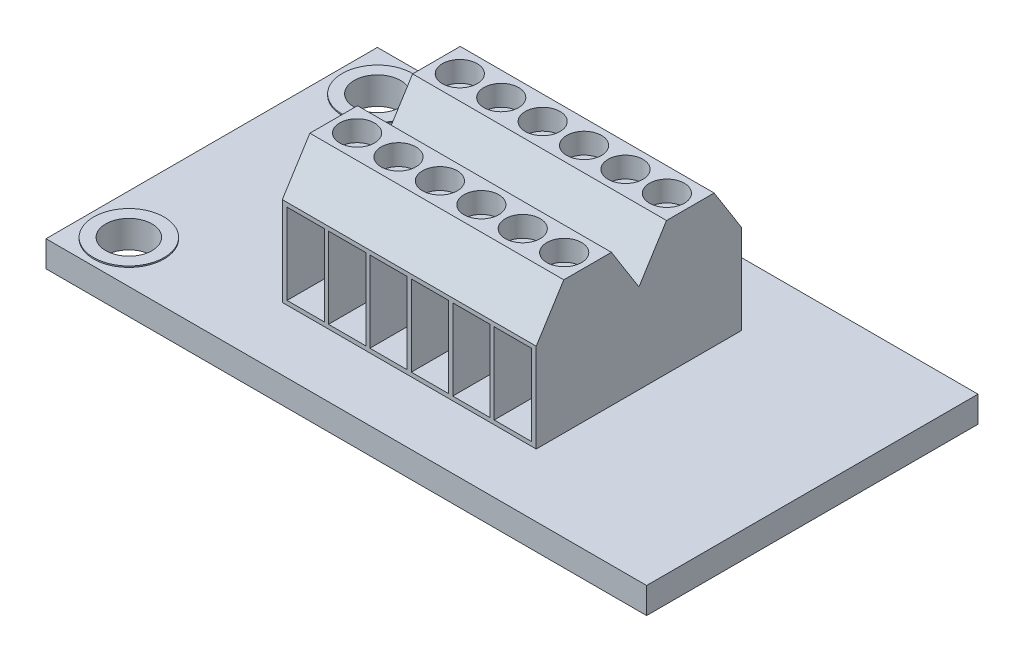
from build123d import *

# Parameters (mm, degrees)
SKETCH1_W           = 36.83
SKETCH1_H           = 20.32
BOSS_EXTRUDE1_DEPTH = 1.6002
SKETCH5_R           = 1.4224
CUT_EXTRUDE3_DEPTH  = 22.092616363
BOSS_EXTRUDE2_DEPTH = 7.7851
BOSS_EXTRUDE3_DEPTH = 7.7851
SKETCH11_W          = 2.286
SKETCH11_H          = 4.953
CUT_EXTRUDE5_DEPTH  = 2.54
SKETCH12_W          = 2.286
SKETCH12_H          = 4.953
CUT_EXTRUDE6_DEPTH  = 2.54
SKETCH13_R          = 1.0668
CUT_EXTRUDE7_DEPTH  = 1.27
SKETCH17_R          = 1.0668
CUT_EXTRUDE9_DEPTH  = 1.27
SKETCH21_R          = 2.159
SKETCH21_R_2        = 1.4224
BOSS_EXTRUDE5_DEPTH = 0.0762


with BuildPart() as part:
    # Sketch1 → Boss-Extrude1 (new body)
    with BuildSketch(Plane(origin=(0, 0, 0), x_dir=(1, 0, 0), z_dir=(0, 1, 0))):
        Rectangle(SKETCH1_W, SKETCH1_H)
    extrude(amount=BOSS_EXTRUDE1_DEPTH)

    # Sketch5 → Cut-Extrude3 (cut, through all)
    with BuildSketch(Plane(origin=(0, 0, 0), x_dir=(1, 0, 0), z_dir=(0, 1, 0))):
        with Locations(Location((-15.875, 7.62, 0), (0, 0, 270))):
            Circle(SKETCH5_R)
        with Locations(Location((-15.875, -7.62, 0), (0, 0, 270))):
            Circle(SKETCH5_R)
    extrude(amount=CUT_EXTRUDE3_DEPTH, mode=Mode.SUBTRACT)

    # Sketch8 → Boss-Extrude2 (add, symmetric)
    with BuildSketch(Plane(origin=(0, 0, 0), x_dir=(0, 0, -1), z_dir=(1, 0, 0))):
        Polygon((0, 1.6002), (6.2992, 1.6002), (6.2992, 7.0612), (4.6101, 9.742765812), (1.6891, 9.742765812), (0, 7.0612), align=None)
    extrude(amount=BOSS_EXTRUDE2_DEPTH, both=True)

    # Sketch10 → Boss-Extrude3 (add, symmetric)
    with BuildSketch(Plane(origin=(0, 0, 0), x_dir=(0, 0, -1), z_dir=(1, 0, 0))):
        Polygon((-6.2992, 1.6002), (0, 1.6002), (0, 7.0612), (-1.6891, 9.742765812), (-4.6101, 9.742765812), (-6.2992, 7.0612), align=None)
    extrude(amount=BOSS_EXTRUDE3_DEPTH, both=True)

    # Sketch11 → Cut-Extrude5 (cut)
    with BuildSketch(Plane.XY.offset(6.2992)):
        with Locations((-1.27, 4.3307)):
            Rectangle(SKETCH11_W, SKETCH11_H)
        with Locations((-3.81, 4.3307)):
            Rectangle(SKETCH11_W, SKETCH11_H)
        with Locations((-6.35, 4.3307)):
            Rectangle(SKETCH11_W, SKETCH11_H)
        with Locations((1.27, 4.3307)):
            Rectangle(SKETCH11_W, SKETCH11_H)
        with Locations((3.81, 4.3307)):
            Rectangle(SKETCH11_W, SKETCH11_H)
        with Locations((6.35, 4.3307)):
            Rectangle(SKETCH11_W, SKETCH11_H)
    extrude(amount=-CUT_EXTRUDE5_DEPTH, mode=Mode.SUBTRACT)

    # Sketch12 → Cut-Extrude6 (cut)
    with BuildSketch(Plane(origin=(0, 0, -6.2992), x_dir=(-1, 0, 0), z_dir=(0, 0, -1))):
        with Locations((-1.27, 4.3307)):
            Rectangle(SKETCH12_W, SKETCH12_H)
        with Locations((-3.81, 4.3307)):
            Rectangle(SKETCH12_W, SKETCH12_H)
        with Locations((-6.35, 4.3307)):
            Rectangle(SKETCH12_W, SKETCH12_H)
        with Locations((1.27, 4.3307)):
            Rectangle(SKETCH12_W, SKETCH12_H)
        with Locations((3.81, 4.3307)):
            Rectangle(SKETCH12_W, SKETCH12_H)
        with Locations((6.35, 4.3307)):
            Rectangle(SKETCH12_W, SKETCH12_H)
    extrude(amount=-CUT_EXTRUDE6_DEPTH, mode=Mode.SUBTRACT)

    # Sketch13 → Cut-Extrude7 (cut)
    with BuildSketch(Plane(origin=(0, 9.742765812, 0), x_dir=(1, 0, 0), z_dir=(0, 1, 0))):
        with Locations(Location((-1.27, -3.1496, 0), (0, 0, 270))):
            Circle(SKETCH13_R)
        with Locations(Location((-3.81, -3.1496, 0), (0, 0, 270))):
            Circle(SKETCH13_R)
        with Locations(Location((-6.35, -3.1496, 0), (0, 0, 270))):
            Circle(SKETCH13_R)
        with Locations(Location((1.27, -3.1496, 0), (0, 0, 270))):
            Circle(SKETCH13_R)
        with Locations(Location((3.81, -3.1496, 0), (0, 0, 270))):
            Circle(SKETCH13_R)
        with Locations(Location((6.35, -3.1496, 0), (0, 0, 270))):
            Circle(SKETCH13_R)
    extrude(amount=-CUT_EXTRUDE7_DEPTH, mode=Mode.SUBTRACT)

    # Sketch17 → Cut-Extrude9 (cut)
    with BuildSketch(Plane(origin=(0, 9.742765812, 0), x_dir=(1, 0, 0), z_dir=(0, 1, 0))):
        with Locations(Location((-1.27, 3.1496, 0), (0, 0, 270))):
            Circle(SKETCH17_R)
        with Locations(Location((-3.81, 3.1496, 0), (0, 0, 270))):
            Circle(SKETCH17_R)
        with Locations(Location((-6.35, 3.1496, 0), (0, 0, 270))):
            Circle(SKETCH17_R)
        with Locations(Location((1.27, 3.1496, 0), (0, 0, 270))):
            Circle(SKETCH17_R)
        with Locations(Location((3.81, 3.1496, 0), (0, 0, 270))):
            Circle(SKETCH17_R)
        with Locations(Location((6.35, 3.1496, 0), (0, 0, 270))):
            Circle(SKETCH17_R)
    extrude(amount=-CUT_EXTRUDE9_DEPTH, mode=Mode.SUBTRACT)

    # Sketch21 → Boss-Extrude5 (add)
    # profile 1 of 2: a face of its own
    with BuildSketch(Plane(origin=(0, 1.6002, 0), x_dir=(1, 0, 0), z_dir=(0, 1, 0))):
        with Locations(Location((-15.875, -7.62, 0), (0, 0, 270))):
            Circle(SKETCH21_R)
        with Locations(Location((-15.875, -7.62, 0), (0, 0, 270))):
            Circle(SKETCH21_R_2, mode=Mode.SUBTRACT)
    # profile 2 of 2: a face of its own
    with BuildSketch(Plane(origin=(0, 1.6002, 0), x_dir=(1, 0, 0), z_dir=(0, 1, 0))):
        with Locations(Location((-15.875, 7.62, 0), (0, 0, 270))):
            Circle(SKETCH21_R)
        with Locations(Location((-15.875, 7.62, 0), (0, 0, 270))):
            Circle(SKETCH21_R_2, mode=Mode.SUBTRACT)
    extrude(amount=BOSS_EXTRUDE5_DEPTH)


solid = part.part
